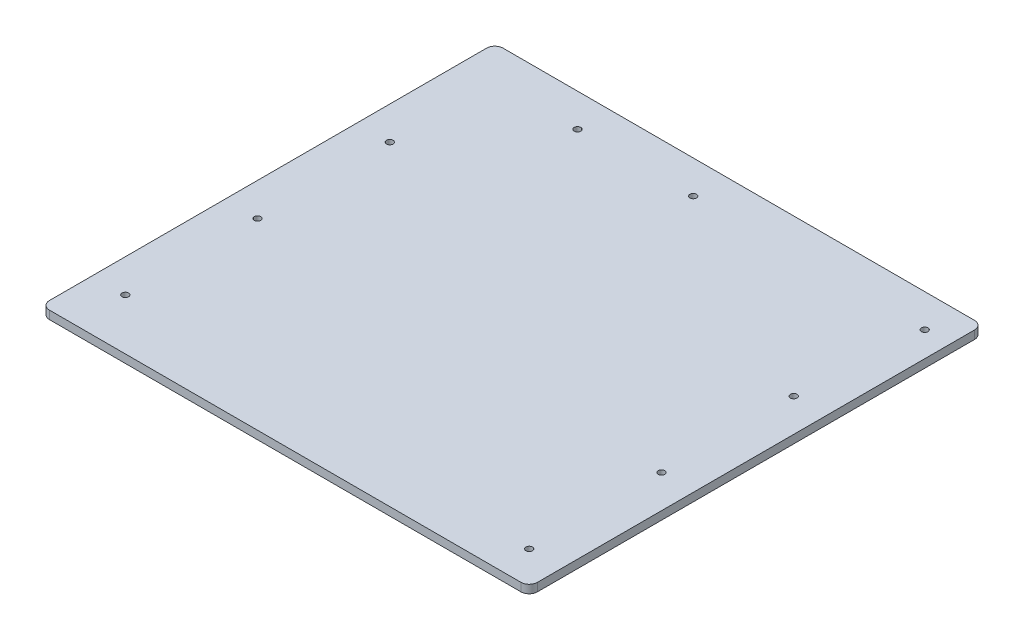
from build123d import *

# Parameters (mm, degrees)
SKETCH1_W           = 187.452
SKETCH1_H           = 174.244
SKETCH1_R           = 1.27
BOSS_EXTRUDE1_DEPTH = 3.175
SKETCH2_R           = 1.27
CUT_EXTRUDE3_DEPTH  = 129.003463176
FILLET1_R           = 3.175


with BuildPart() as part:
    # Sketch1 → Boss-Extrude1 (new body)
    with BuildSketch(Plane(origin=(0, 0, 0), x_dir=(1, 0, 0), z_dir=(0, 1, 0))):
        Rectangle(SKETCH1_W, SKETCH1_H)
        with Locations(Location((-81.026, -67.49288, 0), (0, 0, 270))):
            Circle(SKETCH1_R, mode=Mode.SUBTRACT)
        with Locations(Location((-81.026, -16.69288, 0), (0, 0, 270))):
            Circle(SKETCH1_R, mode=Mode.SUBTRACT)
        with Locations(Location((-81.026, 34.10712, 0), (0, 0, 270))):
            Circle(SKETCH1_R, mode=Mode.SUBTRACT)
        with Locations(Location((-4.826, 74.422, 0), (0, 0, 270))):
            Circle(SKETCH1_R, mode=Mode.SUBTRACT)
        with Locations(Location((84.074, 74.422, 0), (0, 0, 270))):
            Circle(SKETCH1_R, mode=Mode.SUBTRACT)
        with Locations(Location((-49.276, 74.422, 0), (0, 0, 270))):
            Circle(SKETCH1_R, mode=Mode.SUBTRACT)
    extrude(amount=BOSS_EXTRUDE1_DEPTH)

    # Sketch2 → Cut-Extrude3 (cut, through all)
    with BuildSketch(Plane(origin=(0, 3.175, 0), x_dir=(1, 0, 0), z_dir=(0, 1, 0))):
        with Locations(Location((81.026, -74.422, 0), (0, 0, 270))):
            Circle(SKETCH2_R)
        with Locations(Location((81.026, -23.622, 0), (0, 0, 270))):
            Circle(SKETCH2_R)
        with Locations(Location((81.026, 27.178, 0), (0, 0, 270))):
            Circle(SKETCH2_R)
    extrude(amount=-CUT_EXTRUDE3_DEPTH, mode=Mode.SUBTRACT)

    # Fillet1
    fillet1_edges = [part.edges().sort_by_distance(p)[0] for p in [
        (93.726, 1.5875, 87.122),
        (-93.726, 1.5875, 87.122),
        (-93.726, 1.5875, -87.122),
        (93.726, 1.5875, -87.122),
    ]]
    fillet(fillet1_edges, radius=FILLET1_R)


solid = part.part
